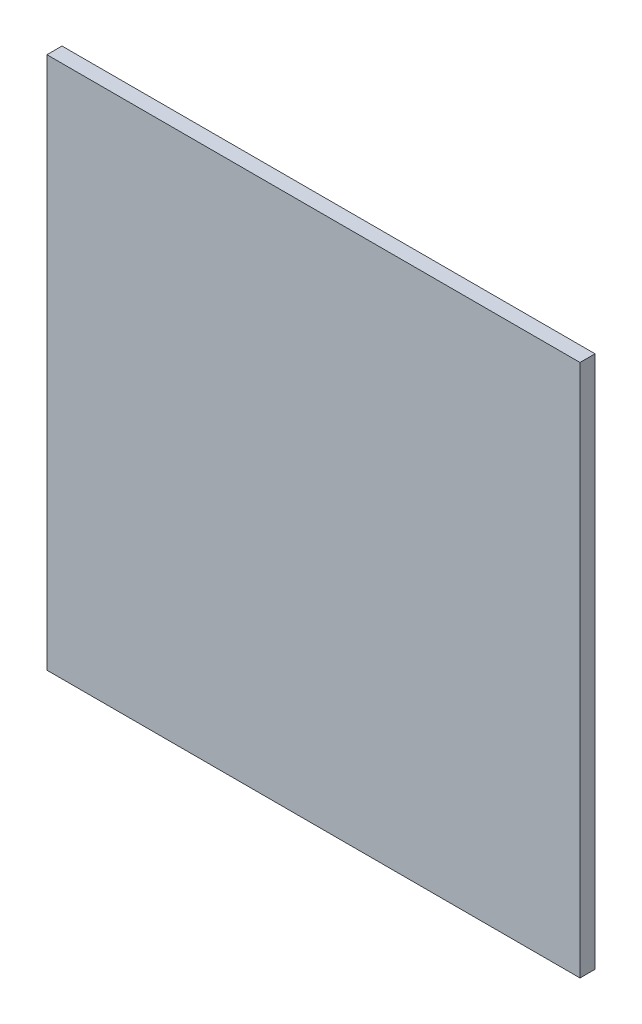
from build123d import *

# Parameters (mm, degrees)
ESBO_O1_W                = 354
ESBO_O1_H                = 354
RESSALTO_EXTRUS_O1_DEPTH = 10


with BuildPart() as part:
    # Esboço1 → Ressalto-extrusão1 (new body)
    with BuildSketch(Plane.XY):
        Rectangle(ESBO_O1_W, ESBO_O1_H)
    extrude(amount=RESSALTO_EXTRUS_O1_DEPTH)


solid = part.part
